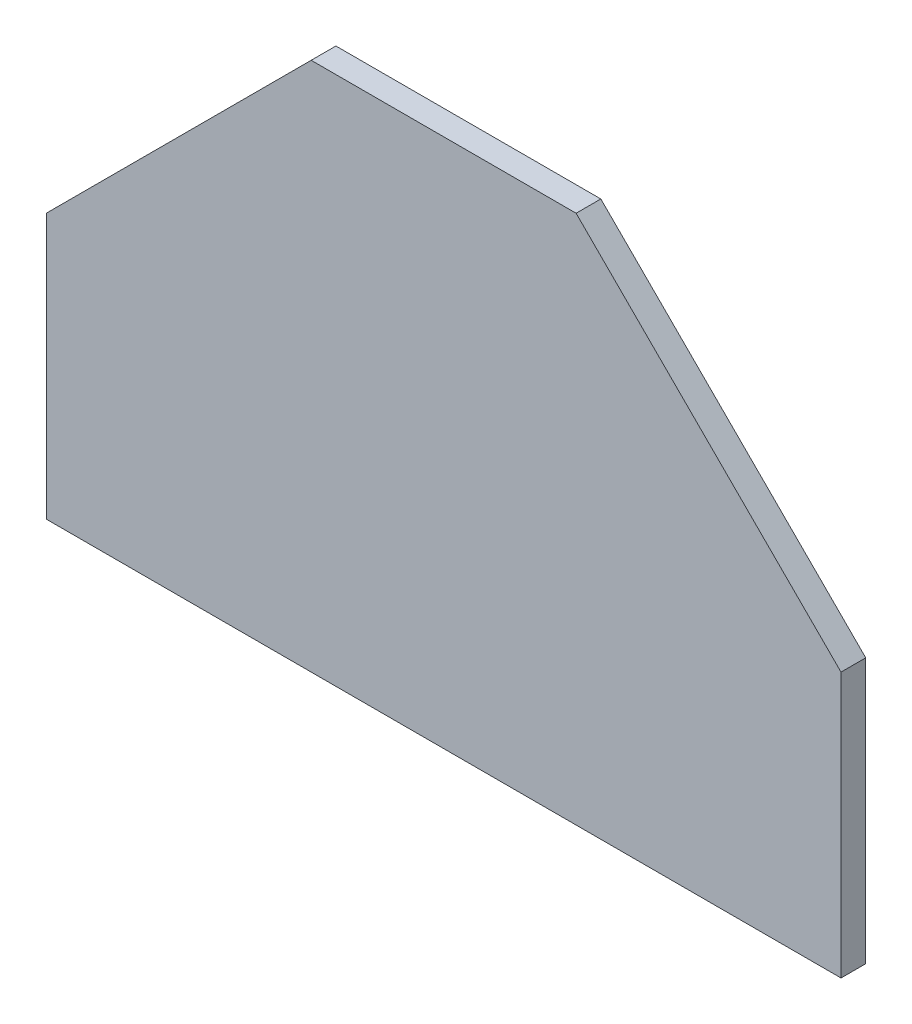
from build123d import *

# Parameters (mm, degrees)
BOSS_EXTRUDE1_DEPTH = 3.556


with BuildPart() as part:
    # Sketch2 → Boss-Extrude1 (new body)
    with BuildSketch(Plane.XY):
        Polygon((-16.743942789, 49.748963039), (21.356057211, 87.848963039), (59.456057211, 87.848963039), (97.556057211, 49.748963039), (97.556057211, 11.648963039), (-16.743942789, 11.648963039), align=None)
    extrude(amount=BOSS_EXTRUDE1_DEPTH)


solid = part.part
